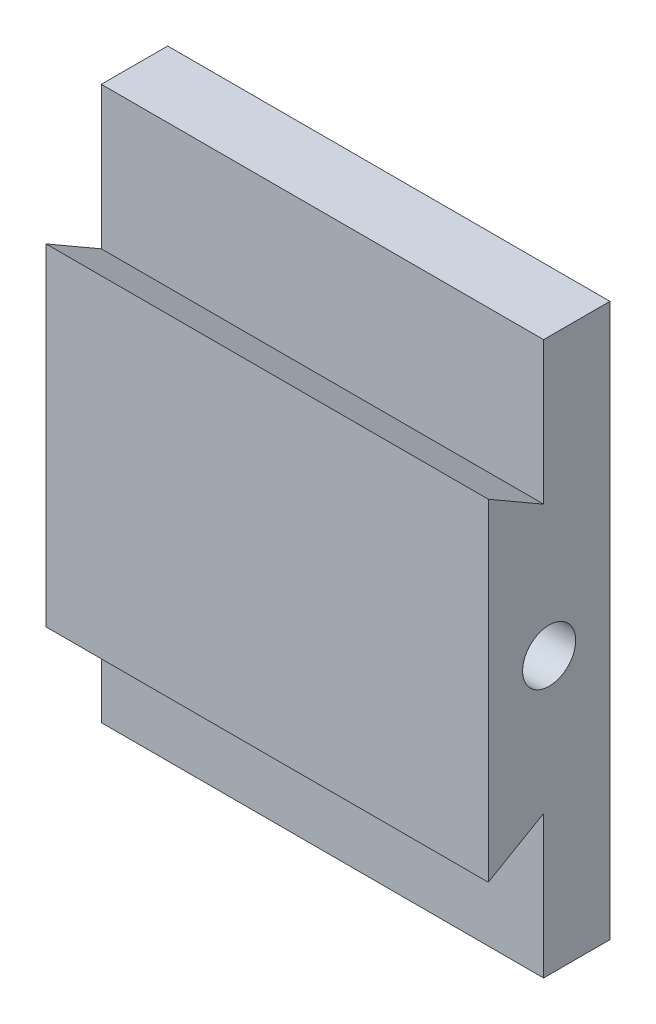
from build123d import *

# Parameters (mm, degrees)
BOSS_EXTRUDE1_DEPTH = 4
SKETCH2_R           = 0.24
CUT_EXTRUDE1_DEPTH  = 5.843552415


with BuildPart() as part:
    # Sketch1 → Boss-Extrude1 (new body)
    with BuildSketch(Plane(origin=(0, 0, 0), x_dir=(0, 0, -1), z_dir=(1, 0, 0))):
        Polygon((0, -1.5), (0, 1.5), (0.5, 1.211324865), (0.5, 2.5), (1.1, 2.5), (1.1, -2.5), (0.5, -2.5), (0.5, -1.211324865), align=None)
    extrude(amount=BOSS_EXTRUDE1_DEPTH)

    # Sketch2 → Cut-Extrude1 (cut, through all)
    with BuildSketch(Plane(origin=(4, 0, 0), x_dir=(0, 0, -1), z_dir=(1, 0, 0))):
        with Locations((0.55, 0)):
            Circle(SKETCH2_R)
    extrude(amount=-CUT_EXTRUDE1_DEPTH, mode=Mode.SUBTRACT)


solid = part.part
